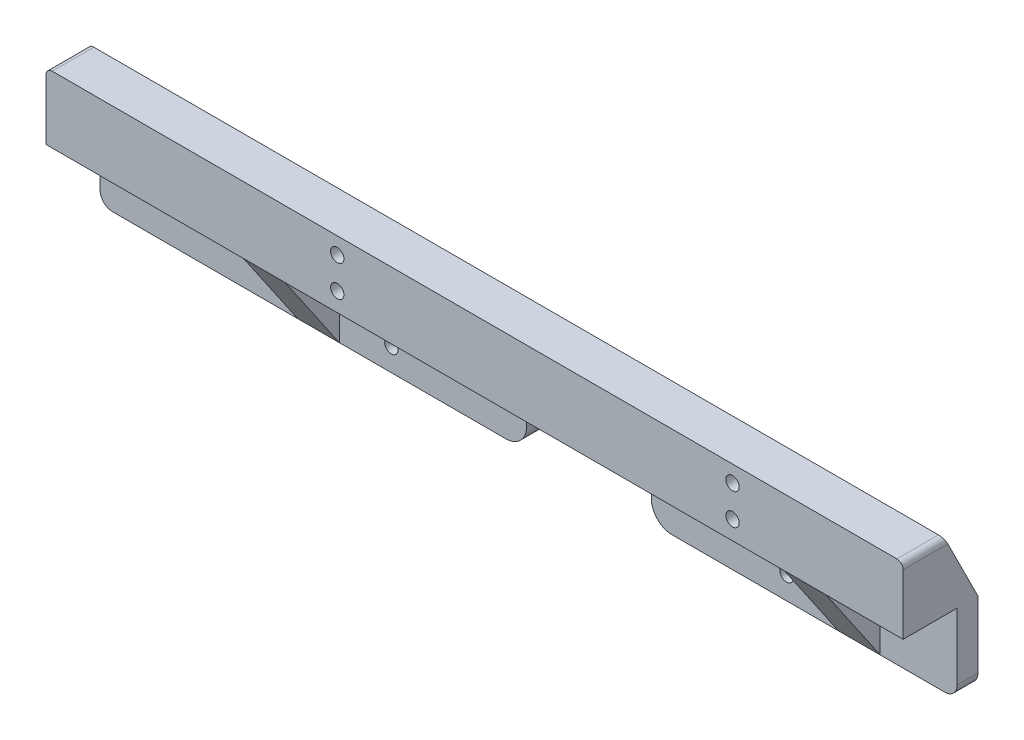
from build123d import *

# Parameters (mm, degrees)
SKETCH_1_W           = 235
SKETCH_1_H           = 35
SKETCH_1_R           = 1.6
EXTRUDE_1_DEPTH      = 18
FILLET_1_R           = 1.5
CUT_EXTRUDE_1_DEPTH  = 237.337153237
SKETCH_3_W           = 13
SKETCH_3_H           = 19
CUT_EXTRUDE_2_DEPTH  = 237.337153237
SKETCH_5_R           = 1.6
CUT_EXTRUDE_5_DEPTH  = 121.151987083
SKETCH_6_R           = 3
CUT_EXTRUDE_6_DEPTH  = 10
SKETCH_10_W          = 29
SKETCH_10_H          = 35
CUT_EXTRUDE_9_DEPTH  = 30
FILLET_2_R           = 3
FILLET_5_R           = 1.5
SKETCH_11_W          = 30
SKETCH_11_H          = 19
CUT_EXTRUDE_10_DEPTH = 30
FILLET_6_R           = 5
EXTRUDE_2_DEPTH      = 10


with BuildPart() as part:
    # 草图1 → 凸台-拉伸1 (new body)
    with BuildSketch(Plane.XY):
        Rectangle(SKETCH_1_W, SKETCH_1_H)
        with Locations((-47.5, 13.5)):
            Circle(SKETCH_1_R, mode=Mode.SUBTRACT)
        with Locations(Location((47.5, 13.5, 0), (0, 0, 180))):
            Circle(SKETCH_1_R, mode=Mode.SUBTRACT)
        with Locations((-47.5, 6)):
            Circle(SKETCH_1_R, mode=Mode.SUBTRACT)
        with Locations(Location((47.5, 6, 0), (0, 0, 180))):
            Circle(SKETCH_1_R, mode=Mode.SUBTRACT)
    extrude(amount=EXTRUDE_1_DEPTH)

    # 圆角1
    fillet_1_edges = [part.edges().sort_by_distance(p)[0] for p in [
        (-117.5, 17.5, 9),
        (117.5, 17.5, 9),
    ]]
    fillet(fillet_1_edges, radius=FILLET_1_R)

    # 草图2 → 切除-拉伸1 (cut, through all)
    with BuildSketch(Plane.ZY.offset(117.5)):
        Polygon((0, 1.5), (8, 17.5), (0, 17.5), align=None)
    extrude(amount=-CUT_EXTRUDE_1_DEPTH, mode=Mode.SUBTRACT)

    # 草图3 → 切除-拉伸2 (cut, through all)
    with BuildSketch(Plane.ZY.offset(117.5)):
        with Locations((11.5, -8)):
            Rectangle(SKETCH_3_W, SKETCH_3_H)
    extrude(amount=-CUT_EXTRUDE_2_DEPTH, mode=Mode.SUBTRACT)

    # 草图5 → 切除-拉伸5 (cut, through all)
    with BuildSketch(Plane(origin=(0, 0, 0), x_dir=(-1, 0, 0), z_dir=(0, 0, -1))):
        with Locations((47.5, -4.5)):
            Circle(SKETCH_5_R)
        with Locations((47.5, -12)):
            Circle(SKETCH_5_R)
        with Locations(Location((-47.5, -12, 0), (0, 0, 90))):
            Circle(SKETCH_5_R)
        with Locations(Location((-47.5, -4.5, 0), (0, 0, 90))):
            Circle(SKETCH_5_R)
    extrude(amount=-CUT_EXTRUDE_5_DEPTH, mode=Mode.SUBTRACT)

    # 草图6 → 切除-拉伸6 (cut)
    with BuildSketch(Plane(origin=(0, 0, 0), x_dir=(-1, 0, 0), z_dir=(0, 0, -1))):
        with Locations((47.5, 6)):
            Circle(SKETCH_6_R)
        with Locations((47.5, 13.5)):
            Circle(SKETCH_6_R)
        with Locations((-47.5, 6)):
            Circle(SKETCH_6_R)
        with Locations((-47.5, 13.5)):
            Circle(SKETCH_6_R)
    extrude(amount=-CUT_EXTRUDE_6_DEPTH, mode=Mode.SUBTRACT)

    # 草图10 → 切除-拉伸9 (cut)
    with BuildSketch(Plane(origin=(0, 0, 0), x_dir=(-1, 0, 0), z_dir=(0, 0, -1))):
        with Locations((-103, 0)):
            Rectangle(SKETCH_10_W, SKETCH_10_H)
    extrude(amount=-CUT_EXTRUDE_9_DEPTH, mode=Mode.SUBTRACT)

    # 圆角2
    fillet_2_edges = [part.edges().sort_by_distance(p)[0] for p in [
        (88.5, -17.5, 2.5),
        (-117.5, -17.5, 2.5),
    ]]
    fillet(fillet_2_edges, radius=FILLET_2_R)

    # 圆角5
    fillet_5_edges = [part.edges().sort_by_distance(p)[0] for p in [
        (88.5, 17.5, 13),
    ]]
    fillet(fillet_5_edges, radius=FILLET_5_R)

    # 草图11 → 切除-拉伸10 (cut)
    with BuildSketch(Plane(origin=(0, 0, 0), x_dir=(-1, 0, 0), z_dir=(0, 0, -1))):
        with Locations((0, -8)):
            Rectangle(SKETCH_11_W, SKETCH_11_H)
    extrude(amount=-CUT_EXTRUDE_10_DEPTH, mode=Mode.SUBTRACT)

    # 圆角6
    fillet_6_edges = [part.edges().sort_by_distance(p)[0] for p in [
        (15, 1.5, 2.5),
        (-15, -17.5, 2.5),
        (15, -17.5, 2.5),
        (-15, 1.5, 2.5),
    ]]
    fillet(fillet_6_edges, radius=FILLET_6_R)

    # 草图12 → 凸台-拉伸2 (add)
    with BuildSketch(Plane(origin=(60, 0, 0), x_dir=(0, 0, -1), z_dir=(1, 0, 0))):
        Polygon((-18, 1.5), (-5, -17.5), (-5, 1.5), align=None)
    extrude_2 = extrude(amount=EXTRUDE_2_DEPTH)

    # 镜向1: 凸台-拉伸2 across plane
    add(extrude_2.mirror(Plane(origin=(0, 0, 0), x_dir=(0, 0, 1), z_dir=(1, 0, 0))))


solid = part.part
